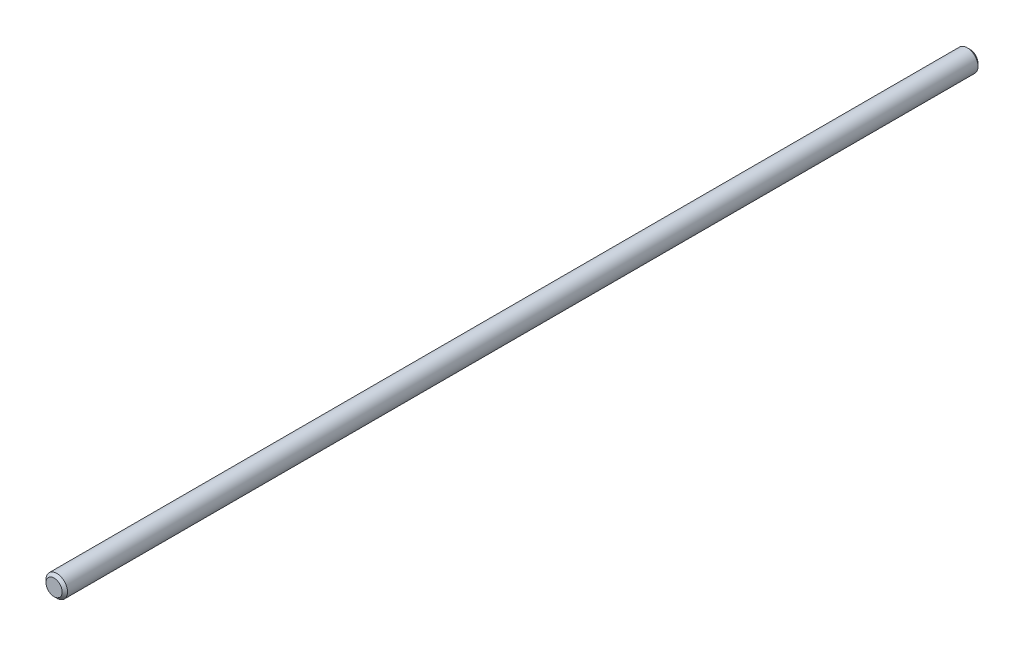
from build123d import *

# Parameters (mm, degrees)
SKETCH_1_R      = 2
EXTRUDE_1_DEPTH = 170
CHAMFER_1_SIZE  = 0.5


with BuildPart() as part:
    # 草图1 → 凸台-拉伸1 (new body)
    with BuildSketch(Plane.XY):
        Circle(SKETCH_1_R)
    extrude(amount=-EXTRUDE_1_DEPTH)

    # 倒角1
    chamfer_1_edges = [part.edges().sort_by_distance(p)[0] for p in [
        (-2, 0, 0),
        (-2, 0, -170),
    ]]
    chamfer(chamfer_1_edges, length=CHAMFER_1_SIZE)


solid = part.part
